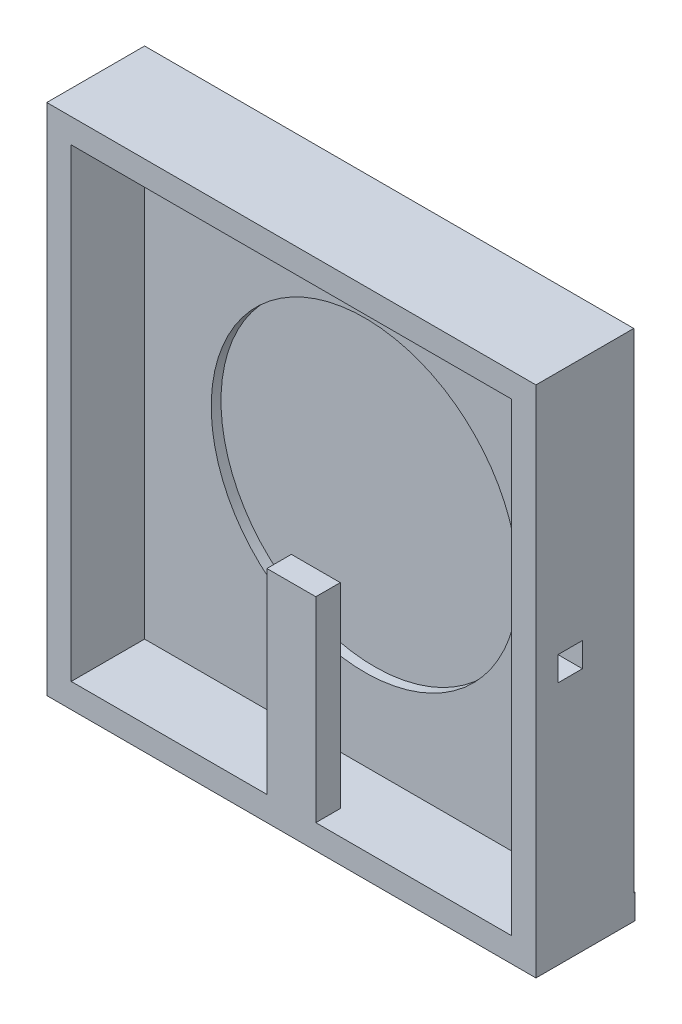
from build123d import *

# Parameters (mm, degrees)
SKETCH1_W           = 1500
SKETCH1_H           = 1000
BOSS_EXTRUDE1_DEPTH = 50
SKETCH2_W           = 1000
SKETCH2_H           = 1000
BOSS_EXTRUDE2_DEPTH = 200
SKETCH3_W           = 900
SKETCH3_H           = 950
CUT_EXTRUDE1_DEPTH  = 150
SKETCH4_W           = 100
SKETCH4_H           = 50
BOSS_EXTRUDE3_DEPTH = 400
SKETCH5_W           = 50
SKETCH5_H           = 50
CUT_EXTRUDE2_DEPTH  = 110
SKETCH7_W           = 1500
SKETCH7_H           = 500
CUT_EXTRUDE3_DEPTH  = 1347.291201784
SKETCH8_W           = 1500
SKETCH8_H           = 297.02623805
CUT_EXTRUDE4_DEPTH  = 1347.291201784
SKETCH9_W           = 250
SKETCH9_H           = 202.97376195
CUT_EXTRUDE5_DEPTH  = 1267.372120682
SKETCH10_R          = 313.8
CUT_EXTRUDE6_DEPTH  = 20


with BuildPart() as part:
    # Sketch1 → Boss-Extrude1 (new body)
    with BuildSketch(Plane(origin=(0, 0, 0), x_dir=(1, 0, 0), z_dir=(0, 1, 0))):
        Rectangle(SKETCH1_W, SKETCH1_H)
    extrude(amount=BOSS_EXTRUDE1_DEPTH)

    # Sketch2 → Boss-Extrude2 (add)
    with BuildSketch(Plane.XY):
        with Locations((0, 550)):
            Rectangle(SKETCH2_W, SKETCH2_H)
    extrude(amount=-BOSS_EXTRUDE2_DEPTH)

    # Sketch3 → Cut-Extrude1 (cut)
    with BuildSketch(Plane.XY):
        with Locations((0, 525)):
            Rectangle(SKETCH3_W, SKETCH3_H)
    extrude(amount=-CUT_EXTRUDE1_DEPTH, mode=Mode.SUBTRACT)

    # Sketch4 → Boss-Extrude3 (add)
    with BuildSketch(Plane(origin=(0, 50, 0), x_dir=(1, 0, 0), z_dir=(0, 1, 0))):
        with Locations((0, 25)):
            Rectangle(SKETCH4_W, SKETCH4_H)
    extrude(amount=BOSS_EXTRUDE3_DEPTH)

    # Sketch5 → Cut-Extrude2 (cut)
    with BuildSketch(Plane(origin=(500, 0, 0), x_dir=(0, 0, -1), z_dir=(1, 0, 0))):
        with Locations((70, 525)):
            Rectangle(SKETCH5_W, SKETCH5_H)
    extrude(amount=-CUT_EXTRUDE2_DEPTH, mode=Mode.SUBTRACT)

    # Sketch7 → Cut-Extrude3 (cut, through all)
    with BuildSketch(Plane(origin=(0, 50, 0), x_dir=(1, 0, 0), z_dir=(0, 1, 0))):
        with Locations((0, -250)):
            Rectangle(SKETCH7_W, SKETCH7_H)
    extrude(amount=-CUT_EXTRUDE3_DEPTH, mode=Mode.SUBTRACT)

    # Sketch8 → Cut-Extrude4 (cut, through all)
    with BuildSketch(Plane(origin=(0, 50, 0), x_dir=(1, 0, 0), z_dir=(0, 1, 0))):
        with Locations((0, 351.486880975)):
            Rectangle(SKETCH8_W, SKETCH8_H)
    extrude(amount=-CUT_EXTRUDE4_DEPTH, mode=Mode.SUBTRACT)

    # Sketch9 → Cut-Extrude5 (cut, through all)
    with BuildSketch(Plane(origin=(0, 50, 0), x_dir=(1, 0, 0), z_dir=(0, 1, 0))):
        with Locations((-625, 101.486880975)):
            Rectangle(SKETCH9_W, SKETCH9_H)
        with Locations((625, 101.486880975)):
            Rectangle(SKETCH9_W, SKETCH9_H)
    extrude(amount=-CUT_EXTRUDE5_DEPTH, mode=Mode.SUBTRACT)

    # Sketch10 → Cut-Extrude6 (cut)
    with BuildSketch(Plane.XY.offset(-150)):
        with Locations((0, 530)):
            Circle(SKETCH10_R)
    extrude(amount=-CUT_EXTRUDE6_DEPTH, mode=Mode.SUBTRACT)


solid = part.part
